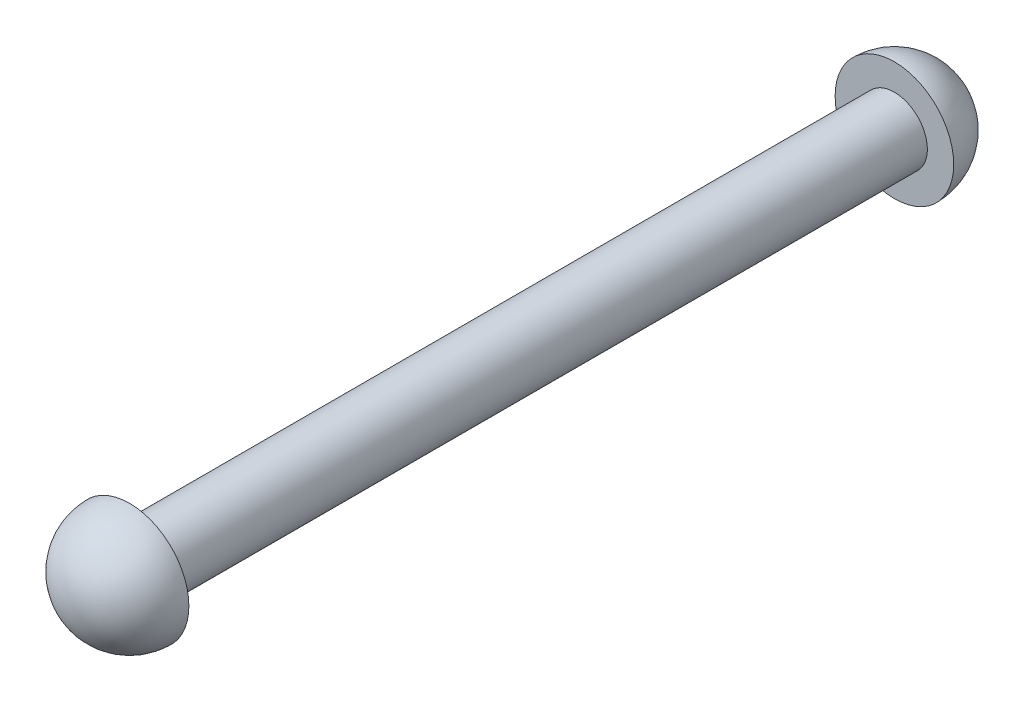
from build123d import *

# Parameters (mm, degrees)
SKETCH2_W = 73.66
SKETCH2_H = 3.175


with BuildPart() as part:
    # Sketch2 → Revolve1 (revolve)
    with BuildSketch(Plane(origin=(0, 0, 0), x_dir=(0, 0, -1), z_dir=(1, 0, 0))):
        with Locations((0, 1.5875)):
            Rectangle(SKETCH2_W, SKETCH2_H)
        with BuildLine():
            ThreePointArc((-36.83, 5.709819934), (-40.867452395, 4.037452395), (-42.539819934, 0))
            Line((-42.539819934, 0), (-36.83, 0))
            Line((-36.83, 0), (-36.83, 3.175))
            Line((-36.83, 3.175), (-36.83, 5.709819934))
        make_face()
        with BuildLine():
            Line((36.83, 3.175), (36.83, 0))
            Line((36.83, 0), (42.539819934, 0))
            ThreePointArc((42.539819934, 0), (40.867452395, 4.037452395), (36.83, 5.709819934))
            Line((36.83, 5.709819934), (36.83, 3.175))
        make_face()
    revolve(axis=Axis((0, 0, 42.539819934), (0, 0, -1)))


solid = part.part
